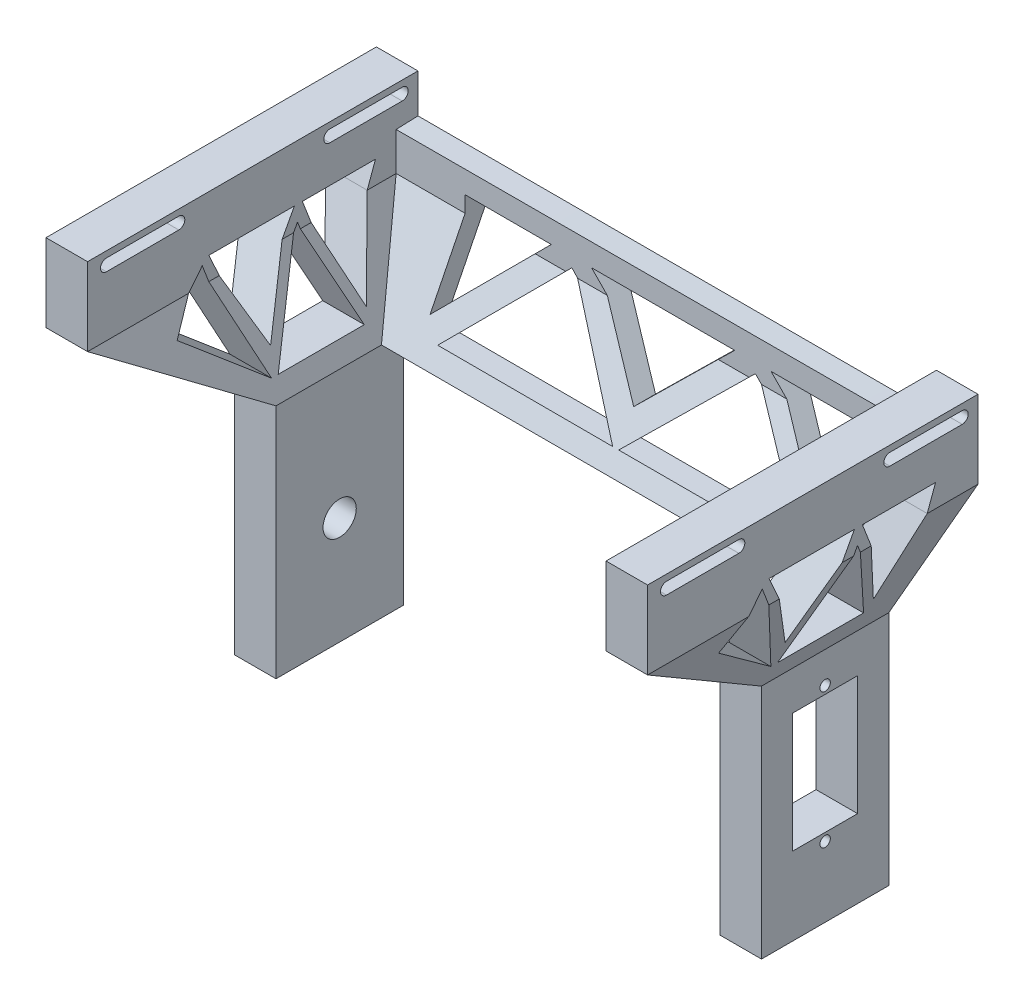
from build123d import *

# Parameters (mm, degrees)
BOSS_EXTRU_1_DEPTH            = 40.5
BOSS_EXTRU_1_DEPTH_BACK       = 5
ESQUISSE1_W                   = 8
ESQUISSE1_H                   = 24.5
BOSS_EXTRU_1_2_DEPTH          = 40.5
BOSS_EXTRU_1_2_DEPTH_BACK     = 5
ESQUISSE3_R                   = 3.2
ENL_V_MAT_EXTRU_1_DEPTH       = 10.5
ESQUISSE4_W                   = 12.5
ESQUISSE4_H                   = 23
ENL_V_MAT_EXTRU_2_DEPTH       = 10.5
ESQUISSE5_W                   = 8
ESQUISSE5_H                   = 63.6
BOSS_EXTRU_2_DEPTH            = 15
BOSS_EXTRU_2_2_DEPTH          = 15
ENL_V_MAT_EXTRU_3_DEPTH       = 145.290375632
ESQUISSE14_R                  = 1
ENL_V_MAT_EXTRU_4_DEPTH       = 10
ENL_V_MAT_EXTRU_9_DEPTH       = 150
ENL_V_MAT_EXTRU_13_DEPTH      = 20
ENL_V_MAT_EXTRU_13_DEPTH_BACK = 20


with BuildPart() as part:
    # Esquisse1 → Boss.-Extru.1 (new, two sides: drawn at the far end of the back side and taken through both)
    with BuildSketch(Plane(origin=(0, 0, 0), x_dir=(1, 0, 0), z_dir=(0, 1, 0)).offset(-BOSS_EXTRU_1_DEPTH_BACK)):
        with Locations((-46.725, 0)):
            Rectangle(ESQUISSE1_W, ESQUISSE1_H)
    extrude(amount=BOSS_EXTRU_1_DEPTH + BOSS_EXTRU_1_DEPTH_BACK)

    # Esquisse3 → Enlèv. mat.-Extru.1 (cut)
    with BuildSketch(Plane.ZY.offset(50.725)):
        with Locations((0, 15.67)):
            Circle(ESQUISSE3_R)
    extrude(amount=-ENL_V_MAT_EXTRU_1_DEPTH, mode=Mode.SUBTRACT)


with BuildPart() as body_2:
    # Esquisse1 → Boss.-Extru.1 2 (new, two sides: drawn at the far end of the back side and taken through both)
    with BuildSketch(Plane(origin=(0, 0, 0), x_dir=(1, 0, 0), z_dir=(0, 1, 0)).offset(-BOSS_EXTRU_1_2_DEPTH_BACK)):
        with Locations((46.725, 0)):
            Rectangle(ESQUISSE1_W, ESQUISSE1_H)
    extrude(amount=BOSS_EXTRU_1_2_DEPTH + BOSS_EXTRU_1_2_DEPTH_BACK)

    # Esquisse4 → Enlèv. mat.-Extru.2 (cut)
    with BuildSketch(Plane(origin=(50.725, 0, 0), x_dir=(0, 0, -1), z_dir=(1, 0, 0))):
        with Locations((0, 21.5)):
            Rectangle(ESQUISSE4_W, ESQUISSE4_H)
    extrude(amount=-ENL_V_MAT_EXTRU_2_DEPTH, mode=Mode.SUBTRACT)


with BuildPart() as body_3:
    # Esquisse5 → Boss.-Extru.2 (new body)
    with BuildSketch(Plane(origin=(0, 60.5, 0), x_dir=(1, 0, 0), z_dir=(0, 1, 0))):
        with Locations((-53.9, -9.55)):
            Rectangle(ESQUISSE5_W, ESQUISSE5_H)
    extrude(amount=BOSS_EXTRU_2_DEPTH)


with BuildPart() as body_4:
    # Esquisse5 → Boss.-Extru.2 2 (new body)
    with BuildSketch(Plane(origin=(0, 60.5, 0), x_dir=(1, 0, 0), z_dir=(0, 1, 0))):
        with Locations((53.9, -9.55)):
            Rectangle(ESQUISSE5_W, ESQUISSE5_H)
    extrude(amount=BOSS_EXTRU_2_2_DEPTH)


with BuildPart() as enl_v_mat_extru_3_tool:
    # Esquisse6 → Enlèv. mat.-Extru.3 (new, through all)
    with BuildSketch(Plane.ZY.offset(57.9)):
        with BuildLine():
            Line((-19.215648746, 74.3), (-5.284351254, 74.3))
            ThreePointArc((-5.284351254, 74.3), (-4.134351254, 73.15), (-5.284351254, 72))
            Line((-5.284351254, 72), (-19.215648746, 72))
            ThreePointArc((-19.215648746, 72), (-20.365648746, 73.15), (-19.215648746, 74.3))
        make_face()
        with BuildLine():
            Line((23.784351254, 74.3), (37.715648746, 74.3))
            ThreePointArc((37.715648746, 74.3), (38.865648746, 73.15), (37.715648746, 72))
            Line((37.715648746, 72), (23.784351254, 72))
            ThreePointArc((23.784351254, 72), (22.634351254, 73.15), (23.784351254, 74.3))
        make_face()
    extrude(amount=-ENL_V_MAT_EXTRU_3_DEPTH)


with BuildPart() as body_3_1:
    add(body_3.part)

    # Enlèv. mat.-Extru.3: cut by enl_v_mat_extru_3_tool
    add(enl_v_mat_extru_3_tool.part, mode=Mode.SUBTRACT)


    add(part.part)  # lissage2 joins it to this body
    # loft from a face of the part (lissage2)
    loft([body_3_1.faces().sort_by_distance((-53.9, 60.5, 9.55))[0], body_3_1.faces().sort_by_distance((-46.725, 40.5, 0))[0]])



with BuildPart() as body_4_1:
    add(body_4.part)

    # Enlèv. mat.-Extru.3: cut by enl_v_mat_extru_3_tool
    add(enl_v_mat_extru_3_tool.part, mode=Mode.SUBTRACT)


    add(body_2.part)  # lissage1 joins it to this body
    # loft from a face of the part (lissage1)
    loft([body_4_1.faces().sort_by_distance((53.9, 60.5, 9.55))[0], body_4_1.faces().sort_by_distance((46.725, 40.5, 0))[0]])

    # Esquisse14 → Enlèv. mat.-Extru.4 (cut)
    with BuildSketch(Plane.ZY.offset(-42.725)):
        with Locations((0, 34.5)):
            Circle(ESQUISSE14_R)
        with Locations(Location((0, 8.5, 0), (0, 0, 180))):
            Circle(ESQUISSE14_R)
    extrude(amount=-ENL_V_MAT_EXTRU_4_DEPTH, mode=Mode.SUBTRACT)


with BuildPart() as body_3_2:
    add(body_3_1.part)

    add(body_4_1.part)  # Lissage3 merges body 4
    # Esquisse18 → Lissage3 section 0
    with BuildSketch(Plane.ZY.offset(-49.9)):
        with BuildLine():
            Line((-18.05, 60.5), (-18.05, 68))
            Line((-18.05, 68), (-22.25, 68))
            Line((-22.25, 68), (-22.25, 60.5))
            Line((-22.25, 60.5), (-18.05, 60.5))
        make_face()
    # Esquisse20 → Lissage3 section 1
    with BuildSketch(Plane(origin=(-49.9, 0, 0), x_dir=(0, 0, -1), z_dir=(1, 0, 0))):
        with BuildLine():
            Line((18.05, 60.5), (18.05, 67.836742954))
            Line((18.05, 67.836742954), (22.25, 68))
            Line((22.25, 68), (22.25, 60.5))
            Line((22.25, 60.5), (18.05, 60.5))
        make_face()
    loft()

    # Esquisse19 → Lissage4 section 0
    with BuildSketch(Plane(origin=(-24.980584715, -8.961784767, 0), x_dir=(0, 0, -1), z_dir=(0.9412618068418507, 0.337677673204514, 0))):
        with BuildLine():
            Line((22.25, 73.796455207), (18.05, 73.796455207))
            Line((18.05, 73.796455207), (8.05, 52.548381765))
            Line((8.05, 52.548381765), (12.25, 52.548381765))
            Line((12.25, 52.548381765), (22.25, 73.796455207))
        make_face()
    # Esquisse17 → Lissage4 section 1
    with BuildSketch(Plane(origin=(24.980584715, -8.961784767, 0), x_dir=(0, 0, 1), z_dir=(-0.9412618068418507, 0.337677673204514, 0))):
        with BuildLine():
            Line((-22.25, 73.796455207), (-18.05, 73.796455207))
            Line((-18.05, 73.796455207), (-8.05, 52.548381765))
            Line((-8.05, 52.548381765), (-12.25, 52.548381765))
            Line((-12.25, 52.548381765), (-22.25, 73.796455207))
        make_face()
    loft()

    # Esquisse21 → Enlèv. mat.-Extru.9 (cut)
    with BuildSketch(Plane.ZY.offset(57.9)):
        Polygon((-12.478064868, 60.5), (-1.693335272, 60.5), (0.005423354, 64.880730664), (-14.077066228, 64.880730664), align=None)
        Polygon((-12.478064868, 60.5), (-7.204390612, 46.288181596), (-1.693335272, 60.5), align=None)
        Polygon((17.981320133, 64.880730664), (1.532279419, 64.880730664), (3.899038167, 60.5), (16.006839034, 60.5), align=None)
        Polygon((16.006839034, 60.5), (3.899038167, 60.5), (10.499973528, 48.282058487), align=None)
        Polygon((0.941725613, 61.894954957), (0.388603676, 60.5), (1.695554528, 60.5), align=None)
        Polygon((1.695554528, 60.5), (0.388603676, 60.5), (-6.071638414, 44.207486295), (10.499973528, 44.207486295), align=None)
        Polygon((18.011859163, 60.5), (11.77593367, 44.207486295), (25.894643265, 55.521193724), (21.904989879, 60.5), align=None)
        Polygon((19.270299185, 63.78790832), (18.011859163, 60.5), (21.904989879, 60.5), align=None)
    extrude(amount=-ENL_V_MAT_EXTRU_9_DEPTH, mode=Mode.SUBTRACT)

    # Esquisse23 → Enlèv. mat.-Extru.13 (cut, two sides: drawn at the far end of the back side and taken through both)
    with BuildSketch(Plane.XY.offset(-18.05).offset(-ENL_V_MAT_EXTRU_13_DEPTH_BACK)):
        Polygon((22.276460809, 63.5978246), (38.978258825, 63.5978246), (38.978258825, 46.481442945), align=None)
        Polygon((19.255367317, 61.703896664), (1.160794542, 44.047600738), (36.484002095, 44.047600738), align=None)
        Polygon((-12.276637083, 63.5978246), (15.273612392, 63.5978246), (1.160794542, 49.826839708), align=None)
        Polygon((-33.691701308, 44.080035592), (-16.067840237, 61.703896664), (0, 44.048681011), align=None)
        Polygon((-36.624234887, 47.012569172), (-20.038979459, 63.5978246), (-36.624234887, 63.5978246), align=None)
    extrude(amount=ENL_V_MAT_EXTRU_13_DEPTH + ENL_V_MAT_EXTRU_13_DEPTH_BACK, mode=Mode.SUBTRACT)


solid = body_3_2.part
